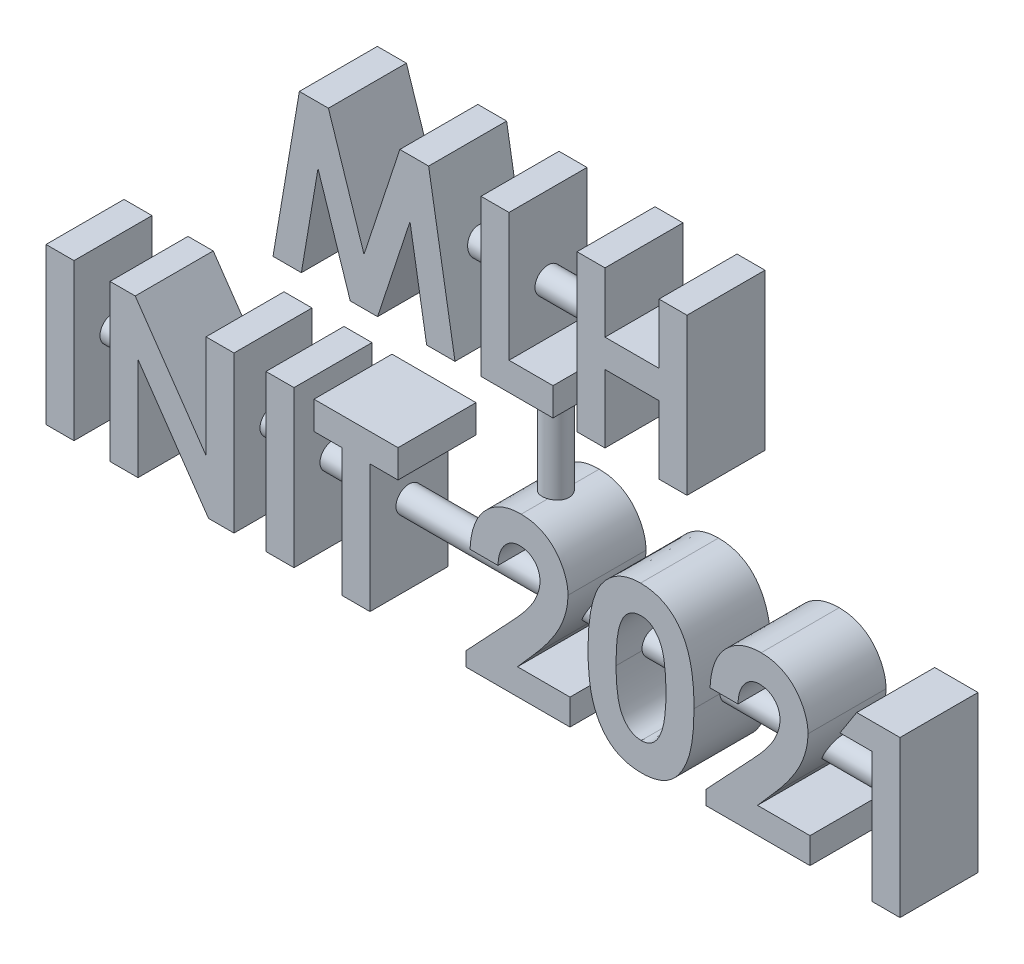
from build123d import *

# Parameters (mm, degrees)
BOSS_EXTRUDE1_DEPTH    = 15
BOSS_EXTRUDE1_2_DEPTH  = 15
BOSS_EXTRUDE1_3_DEPTH  = 15
SKETCH1_W              = 5.384615385
SKETCH1_H              = 30
BOSS_EXTRUDE1_4_DEPTH  = 15
BOSS_EXTRUDE1_5_DEPTH  = 15
BOSS_EXTRUDE1_6_DEPTH  = 15
BOSS_EXTRUDE1_7_DEPTH  = 15
BOSS_EXTRUDE1_8_DEPTH  = 15
BOSS_EXTRUDE1_9_DEPTH  = 15
BOSS_EXTRUDE1_10_DEPTH = 15
BOSS_EXTRUDE1_11_DEPTH = 15
BOSS_EXTRUDE2_START    = -47.574119
SKETCH2_R              = 2.5
BOSS_EXTRUDE2_DEPTH    = 42.189504
BOSS_EXTRUDE3_START    = -158.846154
SKETCH4_R              = 2.5
BOSS_EXTRUDE3_DEPTH    = 153.461539
BOSS_EXTRUDE4_REACH    = 101.896
SKETCH5_R              = 2.5


with BuildPart() as part:
    # Sketch1 → Boss-Extrude1 (new body)
    with BuildSketch(Plane.XY):
        Polygon((-36.087740385, 30), (-30.498798077, 30), (-23.653846154, 9.074519231), (-16.760817308, 30), (-11.225961538, 30), (-6.153846154, 0), (-11.604567308, 0), (-14.807692308, 18.948317308), (-21.045673077, 0), (-26.298076923, 0), (-32.5, 18.948317308), (-35.697115385, 0), (-41.153846154, 0), align=None)
    extrude(amount=BOSS_EXTRUDE1_DEPTH)



with BuildPart() as body_2:
    # Sketch1 → Boss-Extrude1 2 (new body)
    with BuildSketch(Plane.XY):
        Polygon((-1.153846154, 30), (4.230769231, 30), (4.230769231, 5.384615385), (12.692307692, 5.384615385), (12.692307692, 0), (-1.153846154, 0), align=None)
    extrude(amount=BOSS_EXTRUDE1_2_DEPTH)


with BuildPart() as body_3:
    # Sketch1 → Boss-Extrude1 3 (new body)
    with BuildSketch(Plane.XY):
        Polygon((17.307692308, 30), (22.692307692, 30), (22.692307692, 18.461538462), (33.076923077, 18.461538462), (33.076923077, 30), (38.461538462, 30), (38.461538462, 0), (33.076923077, 0), (33.076923077, 13.076923077), (22.692307692, 13.076923077), (22.692307692, 0), (17.307692308, 0), align=None)
    extrude(amount=BOSS_EXTRUDE1_3_DEPTH)


with BuildPart() as body_4:
    # Sketch1 → Boss-Extrude1 4 (new body)
    with BuildSketch(Plane.XY):
        with Locations((-82.115384616, -34.846153846)):
            Rectangle(SKETCH1_W, SKETCH1_H)
    extrude(amount=BOSS_EXTRUDE1_4_DEPTH)



with BuildPart() as body_5:
    # Sketch1 → Boss-Extrude1 5 (new body)
    with BuildSketch(Plane.XY):
        Polygon((-72.5, -19.846153846), (-67.650240385, -19.846153846), (-54.038461538, -39.587740385), (-54.038461538, -19.846153846), (-48.653846154, -19.846153846), (-48.653846154, -49.846153846), (-53.539663462, -49.846153846), (-67.115384615, -30.164663462), (-67.115384615, -49.846153846), (-72.5, -49.846153846), align=None)
    extrude(amount=BOSS_EXTRUDE1_5_DEPTH)


with BuildPart() as body_6:
    # Sketch1 → Boss-Extrude1 6 (new body)
    with BuildSketch(Plane.XY):
        with Locations((-39.807692308, -34.846153846)):
            Rectangle(SKETCH1_W, SKETCH1_H)
    extrude(amount=BOSS_EXTRUDE1_6_DEPTH)


with BuildPart() as body_7:
    # Sketch1 → Boss-Extrude1 7 (new body)
    with BuildSketch(Plane.XY):
        Polygon((-33.269230769, -19.846153846), (-17.115384615, -19.846153846), (-17.115384615, -25.230769231), (-22.5, -25.230769231), (-22.5, -49.846153846), (-27.884615385, -49.846153846), (-27.884615385, -25.230769231), (-33.269230769, -25.230769231), align=None)
    extrude(amount=BOSS_EXTRUDE1_7_DEPTH)


with BuildPart() as body_8:
    # Sketch1 → Boss-Extrude1 8 (new body)
    with BuildSketch(Plane.XY):
        with BuildLine():
            Line((2.115384615, -29.846153846), (-3.269230769, -29.846153846))
            add(Edge.make_bspline(
                [(-3.269230769, -29.846153846), (-3.245975441, -29.438836179), (-3.200535926, -28.642961913), (-3.019789022, -27.486929058), (-2.777594372, -26.394605133), (-2.454353461, -25.369811205), (-2.048180106, -24.412919651), (-1.569526193, -23.520668377), (-1.006163204, -22.697755105), (-0.370081355, -21.948148388), (0.327920434, -21.275669284), (1.07335096, -20.679407064), (1.877612588, -20.187386486), (2.7260108, -19.782499102), (3.618401131, -19.459012896), (4.563226995, -19.24273619), (5.552307578, -19.096271486), (6.229413331, -19.083455237), (6.574519231, -19.076923077)],
                knots=[0, 0, 0, 0, 1.199038563, 2.342849363, 3.436047546, 4.486744587, 5.497670872, 6.488682221, 7.459191391, 8.424610317, 9.374430501, 10.305433194, 11.225809216, 12.140057399, 13.06607119, 14.010487599, 14.985989317, 16, 16, 16, 16], degree=3))
            add(Edge.make_bspline(
                [(6.574519231, -19.076923077), (6.998131827, -19.090140907), (7.825122887, -19.115945208), (9.026806493, -19.336064461), (10.149047593, -19.704247927), (11.191030424, -20.218697328), (12.143884401, -20.872251365), (13.007451516, -21.651507593), (13.755616123, -22.572815215), (14.393121805, -23.597840125), (14.922812834, -24.683197245), (15.293998244, -25.805501515), (15.537974418, -26.93497153), (15.563995987, -27.69549947), (15.576923077, -28.073317308)],
                knots=[0, 0, 0, 0, 1.075374347, 2.099382735, 3.09057751, 4.06680945, 5.040638231, 6.016817125, 7.011024321, 8.044445721, 9.0776792, 10.070479129, 11.0414456, 12, 12, 12, 12], degree=3))
            add(Edge.make_bspline(
                [(15.576923077, -28.073317308), (15.571889951, -28.301848239), (15.561759511, -28.761824553), (15.491321219, -29.457881611), (15.385649862, -30.166897103), (15.226323208, -30.888263116), (15.027629809, -31.622181859), (14.786585996, -32.370849699), (14.497600522, -33.130021963), (14.165495967, -33.908243007), (13.769294391, -34.708039408), (13.307972729, -35.541400427), (12.769286457, -36.407586805), (12.159742226, -37.311489315), (11.476379627, -38.251682361), (10.715862709, -39.225333789), (9.88695084, -40.235874435), (9.298648769, -40.911364147), (8.996394231, -41.258413462)],
                knots=[0, 0, 0, 0, 0.728284026, 1.46585585, 2.227944881, 3.01186502, 3.81876927, 4.650621989, 5.517437689, 6.406905708, 7.346299482, 8.360816762, 9.441613733, 10.596154504, 11.834900912, 13.145207542, 14.533280747, 16, 16, 16, 16], degree=3))
            Line((8.996394231, -41.258413462), (5.865384615, -44.846153846))
            Line((5.865384615, -44.846153846), (15.961538462, -44.846153846))
            Line((15.961538462, -44.846153846), (15.961538462, -49.846153846))
            Line((15.961538462, -49.846153846), (-4.038461538, -49.846153846))
            Line((-4.038461538, -49.846153846), (-4.038461538, -47.117788462))
            Line((-4.038461538, -47.117788462), (4.84375, -37.664663462))
            add(Edge.make_bspline(
                [(4.84375, -37.664663462), (5.100912849, -37.38891287), (5.598961026, -36.854865749), (6.307632254, -36.070560736), (6.948917115, -35.326274), (7.509518046, -34.614080388), (8.018854662, -33.957080564), (8.454215683, -33.335471731), (8.819584321, -32.754873459), (9.216243799, -32.054773344), (9.592939912, -31.219779374), (9.938581394, -30.257832084), (10.149273797, -29.338432016), (10.178356011, -28.739331169), (10.192307692, -28.451923077)],
                knots=[0, 0, 0, 0, 1.246127091, 2.413378631, 3.493388633, 4.492180848, 5.408488754, 6.240484944, 6.999099869, 7.674939598, 8.898438119, 10.020720584, 11.050475521, 12, 12, 12, 12], degree=3))
            add(Edge.make_bspline(
                [(10.192307692, -28.451923077), (10.181876358, -28.173877921), (10.161663974, -27.635120855), (9.93954626, -26.868741796), (9.595433794, -26.174863791), (9.11053073, -25.574220699), (8.52316125, -25.080632441), (7.844400641, -24.713515362), (7.0797828, -24.501690491), (6.543771126, -24.475177585), (6.268028846, -24.461538462)],
                knots=[0, 0, 0, 0, 1.062038974, 2.057870785, 3.028805853, 4.01125022, 4.991535629, 5.949134679, 6.94496649, 8, 8, 8, 8], degree=3))
            add(Edge.make_bspline(
                [(6.268028846, -24.461538462), (6.125576872, -24.466576917), (5.845137285, -24.476495926), (5.432913011, -24.542524083), (5.040651998, -24.658891818), (4.663988164, -24.814808205), (4.306941362, -25.021476494), (3.97041218, -25.276228088), (3.650854855, -25.572589168), (3.349735007, -25.909633054), (3.075676636, -26.285774129), (2.832258993, -26.697577114), (2.630993125, -27.144786391), (2.453791339, -27.621498114), (2.317124843, -28.132832556), (2.21761468, -28.675729437), (2.141963748, -29.249305536), (2.1244055, -29.643585168), (2.115384615, -29.846153846)],
                knots=[0, 0, 0, 0, 0.903469896, 1.778625579, 2.63899355, 3.493148037, 4.358286772, 5.247621495, 6.164656832, 7.118446693, 8.109501108, 9.111810964, 10.146451449, 11.215617525, 12.33435995, 13.498009769, 14.714554818, 16, 16, 16, 16], degree=3))
        make_face()
    extrude(amount=BOSS_EXTRUDE1_8_DEPTH)


with BuildPart() as body_9:
    # Sketch1 → Boss-Extrude1 9 (new body)
    with BuildSketch(Plane.XY):
        with BuildLine():
            add(Edge.make_bspline(
                [(29.525240385, -19.076923077), (29.785878118, -19.080792318), (30.29836154, -19.088400278), (31.053153152, -19.170800691), (31.780226161, -19.295284734), (32.482424967, -19.468896566), (33.154695072, -19.698665641), (33.801929397, -19.973695285), (34.416423979, -20.30841137), (35.00601559, -20.686490378), (35.570477116, -21.114529413), (36.096242121, -21.602516014), (36.59291219, -22.139221588), (37.049736245, -22.732760162), (37.476830795, -23.377732873), (37.872792478, -24.074241993), (38.23459011, -24.825696467), (38.566278578, -25.633452355), (38.862875454, -26.509617569), (39.112698635, -27.464242103), (39.326963816, -28.497543963), (39.507818746, -29.612095194), (39.644515843, -30.809377301), (39.736652438, -32.088594868), (39.799880931, -33.447281753), (39.8050412, -34.379329793), (39.807692308, -34.858173077)],
                knots=[0, 0, 0, 0, 0.879237366, 1.728815576, 2.559023295, 3.367336655, 4.166867292, 4.954216142, 5.737608147, 6.525189134, 7.316157332, 8.124696809, 8.942788509, 9.781158001, 10.649253743, 11.551476218, 12.482711956, 13.461909668, 14.496590415, 15.601789533, 16.789733467, 18.056700938, 19.410929216, 20.8549011, 22.384193279, 24, 24, 24, 24], degree=3))
            add(Edge.make_bspline(
                [(39.807692308, -34.858173077), (39.804827176, -35.343007229), (39.799260277, -36.28503129), (39.739280865, -37.656145416), (39.635993483, -38.94465087), (39.502869252, -40.15041435), (39.320525469, -41.272799109), (39.106975552, -42.314711371), (38.853208987, -43.275773467), (38.546842305, -44.15381992), (38.217161555, -44.962994404), (37.854374251, -45.712983721), (37.464803726, -46.405819256), (37.057385554, -47.051953377), (36.60978357, -47.632338377), (36.143783827, -48.166710381), (35.639095862, -48.634714475), (35.116968991, -49.060469488), (34.558275593, -49.42840726), (33.968777328, -49.750199569), (33.337964464, -50.011211352), (32.677335647, -50.238225459), (31.975630326, -50.401197093), (31.2439985, -50.530509729), (30.474180196, -50.601975823), (29.950056887, -50.610841663), (29.681490385, -50.615384615)],
                knots=[0, 0, 0, 0, 1.643780988, 3.193836972, 4.651895693, 6.025988579, 7.305620092, 8.505800249, 9.631074763, 10.672816429, 11.65661981, 12.592235626, 13.49536222, 14.350718032, 15.179365177, 15.97804903, 16.751647189, 17.51006938, 18.259804725, 19.016521909, 19.783502495, 20.571750527, 21.382245291, 22.22305063, 23.089471752, 24, 24, 24, 24], degree=3))
            add(Edge.make_bspline(
                [(29.681490385, -50.615384615), (29.412931131, -50.610754032), (28.886827502, -50.601682787), (28.114927533, -50.53104111), (27.379418426, -50.400673245), (26.672161488, -50.236974283), (25.998079114, -50.011713643), (25.353939101, -49.742892575), (24.744694327, -49.42310809), (24.16865789, -49.054313057), (23.627796542, -48.631406667), (23.113705301, -48.158912377), (22.627521367, -47.63802784), (22.176640801, -47.062918716), (21.753679487, -46.441261514), (21.363048241, -45.765957211), (21.004981823, -45.037989033), (20.668279848, -44.256342269), (20.375728452, -43.404188959), (20.115371294, -42.473919482), (19.902093558, -41.457779275), (19.730561331, -40.356094784), (19.593610099, -39.171199976), (19.491734124, -37.902522936), (19.431421554, -36.549472745), (19.425913036, -35.61945395), (19.423076923, -35.140625)],
                knots=[0, 0, 0, 0, 0.917216111, 1.796812873, 2.643793957, 3.46689424, 4.273913431, 5.068098542, 5.848489301, 6.620921603, 7.401012384, 8.190319798, 9.003608147, 9.831726257, 10.68377682, 11.569763213, 12.493818149, 13.453288342, 14.474581811, 15.568529029, 16.750744269, 18.018426408, 19.375425659, 20.823733699, 22.36466933, 24, 24, 24, 24], degree=3))
            add(Edge.make_bspline(
                [(19.423076923, -35.140625), (19.428214276, -34.475329869), (19.438126865, -33.191634344), (19.563746468, -31.337067543), (19.748124184, -29.622841794), (20.018931374, -28.051824573), (20.353780719, -26.618197291), (20.782572741, -25.331403934), (21.270721266, -24.17363883), (21.686686523, -23.487771812), (21.887019231, -23.157451923)],
                knots=[0, 0, 0, 0, 1.288568992, 2.486310467, 3.599230591, 4.627010532, 5.572937695, 6.447898582, 7.252493626, 8, 8, 8, 8], degree=3))
            add(Edge.make_bspline(
                [(21.887019231, -23.157451923), (22.119956562, -22.832945768), (22.575394944, -22.19847229), (23.371741685, -21.365527213), (24.227312575, -20.653151796), (25.159680553, -20.077467731), (26.154099831, -19.623483231), (27.219108004, -19.302839092), (28.350772175, -19.116016875), (29.127904838, -19.09014894), (29.525240385, -19.076923077)],
                knots=[0, 0, 0, 0, 1.058512271, 2.069600068, 3.047294572, 4.004278952, 4.967380941, 5.939006123, 6.946246673, 8, 8, 8, 8], degree=3))
        make_face()
        with BuildLine():
            add(Edge.make_bspline(
                [(29.657451923, -24.461538462), (29.421833251, -24.472706318), (28.959895579, -24.494601245), (28.289602008, -24.680458287), (27.657557021, -24.967524509), (27.176777281, -25.312963824), (26.816918427, -25.644108833), (26.565482465, -25.943784297), (26.323012109, -26.278200517), (26.108850081, -26.662447977), (25.906625221, -27.082720213), (25.708990578, -27.540925008), (25.546982067, -28.048316864), (25.387813, -28.596254831), (25.248366046, -29.19988794), (25.131540069, -29.864150223), (25.027166327, -30.593361442), (24.954364398, -31.387999228), (24.886491152, -32.247232196), (24.837836395, -33.172974384), (24.817495062, -34.164976045), (24.811029171, -34.848152867), (24.807692308, -35.200721154)],
                knots=[0, 0, 0, 0, 1.076674018, 2.110852608, 3.161083442, 4.239746716, 4.804137807, 5.395870207, 6.026861976, 6.692161227, 7.405688833, 8.16177676, 8.973626916, 9.841385931, 10.773283133, 11.807421078, 12.927755683, 14.143907515, 15.458935494, 16.872852025, 18.386167141, 20, 20, 20, 20], degree=3))
            add(Edge.make_bspline(
                [(24.807692308, -35.200721154), (24.813184381, -35.657490414), (24.823715838, -36.533379335), (24.878874687, -37.792938103), (24.989436024, -38.939238005), (25.126952004, -39.980047938), (25.320098813, -40.908617974), (25.54232672, -41.733733244), (25.816758425, -42.444875533), (26.133917139, -43.052329558), (26.485184705, -43.569089435), (26.8665011, -44.008337658), (27.264883868, -44.388705895), (27.692767829, -44.697674327), (28.149132181, -44.934453491), (28.630167121, -45.10476582), (29.136178339, -45.209021089), (29.482689605, -45.223477943), (29.657451923, -45.230769231)],
                knots=[0, 0, 0, 0, 1.771748488, 3.397459088, 4.888034009, 6.237357457, 7.467047327, 8.564189669, 9.548206622, 10.417051504, 11.216568818, 11.965764335, 12.669334354, 13.348544111, 14.005342236, 14.656555988, 15.322436492, 16, 16, 16, 16], degree=3))
            add(Edge.make_bspline(
                [(29.657451923, -45.230769231), (29.826216952, -45.22577999), (30.156637894, -45.216011677), (30.638465627, -45.115741256), (31.094116168, -44.952723331), (31.522213767, -44.72212303), (31.924289669, -44.428879466), (32.298378774, -44.071704), (32.641659778, -43.647036426), (32.841656849, -43.331870279), (32.944711538, -43.169471154)],
                knots=[0, 0, 0, 0, 0.992283464, 1.942767638, 2.88273346, 3.832339453, 4.79467288, 5.803907806, 6.868395428, 8, 8, 8, 8], degree=3))
            add(Edge.make_bspline(
                [(32.944711538, -43.169471154), (33.06604108, -42.947557939), (33.320459288, -42.482223924), (33.614872477, -41.696990125), (33.862693091, -40.81137618), (34.07598867, -39.822625976), (34.221869834, -38.726839759), (34.347502515, -37.530966005), (34.408098278, -36.228982778), (34.41795451, -35.326964101), (34.423076923, -34.858173077)],
                knots=[0, 0, 0, 0, 0.710965849, 1.490837728, 2.352621235, 3.297892224, 4.334225155, 5.461620853, 6.680770821, 8, 8, 8, 8], degree=3))
            add(Edge.make_bspline(
                [(34.423076923, -34.858173077), (34.421098245, -34.385312721), (34.417289629, -33.475137257), (34.347412541, -32.168473308), (34.250103356, -30.975052651), (34.107768111, -29.897539709), (33.924627948, -28.933318751), (33.698907005, -28.082452811), (33.432798804, -27.343264995), (33.117226191, -26.716492375), (32.767709915, -26.183821628), (32.396687719, -25.726831444), (32.002590769, -25.336664754), (31.586078124, -25.011853294), (31.137509453, -24.763672976), (30.665453003, -24.588437142), (30.168941021, -24.482425338), (29.830249558, -24.468594727), (29.657451923, -24.461538462)],
                knots=[0, 0, 0, 0, 1.793836731, 3.452829483, 4.963243077, 6.335886805, 7.574563692, 8.684454726, 9.672768357, 10.54971625, 11.340229787, 12.085688095, 12.778991901, 13.440269426, 14.083255152, 14.715733572, 15.344777694, 16, 16, 16, 16], degree=3))
        make_face(mode=Mode.SUBTRACT)
    extrude(amount=BOSS_EXTRUDE1_9_DEPTH)


with BuildPart() as body_10:
    # Sketch1 → Boss-Extrude1 10 (new body)
    with BuildSketch(Plane.XY):
        with BuildLine():
            Line((48.269230769, -29.846153846), (42.884615385, -29.846153846))
            add(Edge.make_bspline(
                [(42.884615385, -29.846153846), (42.907870713, -29.438836179), (42.953310227, -28.642961913), (43.134057132, -27.486929058), (43.376251782, -26.394605133), (43.699492693, -25.369811205), (44.105666048, -24.412919651), (44.584319961, -23.520668377), (45.14768295, -22.697755105), (45.783764799, -21.948148388), (46.481766588, -21.275669284), (47.227197114, -20.679407064), (48.031458742, -20.187386486), (48.879856953, -19.782499102), (49.772247284, -19.459012896), (50.717073149, -19.24273619), (51.706153732, -19.096271486), (52.383259485, -19.083455237), (52.728365385, -19.076923077)],
                knots=[0, 0, 0, 0, 1.199038563, 2.342849363, 3.436047546, 4.486744587, 5.497670872, 6.488682221, 7.459191391, 8.424610317, 9.374430501, 10.305433194, 11.225809216, 12.140057399, 13.06607119, 14.010487599, 14.985989317, 16, 16, 16, 16], degree=3))
            add(Edge.make_bspline(
                [(52.728365385, -19.076923077), (53.151977981, -19.090140907), (53.97896904, -19.115945208), (55.180652647, -19.336064461), (56.302893747, -19.704247927), (57.344876577, -20.218697328), (58.297730555, -20.872251365), (59.16129767, -21.651507593), (59.909462277, -22.572815215), (60.546967958, -23.597840125), (61.076658988, -24.683197245), (61.447844397, -25.805501515), (61.691820572, -26.93497153), (61.717842141, -27.69549947), (61.730769231, -28.073317308)],
                knots=[0, 0, 0, 0, 1.075374347, 2.099382735, 3.09057751, 4.06680945, 5.040638231, 6.016817125, 7.011024321, 8.044445721, 9.0776792, 10.070479129, 11.0414456, 12, 12, 12, 12], degree=3))
            add(Edge.make_bspline(
                [(61.730769231, -28.073317308), (61.725736105, -28.301848239), (61.715605665, -28.761824553), (61.645167373, -29.457881611), (61.539496016, -30.166897103), (61.380169362, -30.888263116), (61.181475962, -31.622181859), (60.94043215, -32.370849699), (60.651446676, -33.130021963), (60.319342121, -33.908243007), (59.923140545, -34.708039408), (59.461818883, -35.541400427), (58.923132611, -36.407586805), (58.31358838, -37.311489315), (57.630225781, -38.251682361), (56.869708863, -39.225333789), (56.040796994, -40.235874435), (55.452494922, -40.911364147), (55.150240385, -41.258413462)],
                knots=[0, 0, 0, 0, 0.728284026, 1.46585585, 2.227944881, 3.01186502, 3.81876927, 4.650621989, 5.517437689, 6.406905708, 7.346299482, 8.360816762, 9.441613733, 10.596154504, 11.834900912, 13.145207542, 14.533280747, 16, 16, 16, 16], degree=3))
            Line((55.150240385, -41.258413462), (52.019230769, -44.846153846))
            Line((52.019230769, -44.846153846), (62.115384615, -44.846153846))
            Line((62.115384615, -44.846153846), (62.115384615, -49.846153846))
            Line((62.115384615, -49.846153846), (42.115384615, -49.846153846))
            Line((42.115384615, -49.846153846), (42.115384615, -47.117788462))
            Line((42.115384615, -47.117788462), (50.997596154, -37.664663462))
            add(Edge.make_bspline(
                [(50.997596154, -37.664663462), (51.254759003, -37.38891287), (51.75280718, -36.854865749), (52.461478408, -36.070560736), (53.102763269, -35.326274), (53.6633642, -34.614080388), (54.172700816, -33.957080564), (54.608061836, -33.335471731), (54.973430475, -32.754873459), (55.370089953, -32.054773344), (55.746786066, -31.219779374), (56.092427548, -30.257832084), (56.303119951, -29.338432016), (56.332202165, -28.739331169), (56.346153846, -28.451923077)],
                knots=[0, 0, 0, 0, 1.246127091, 2.413378631, 3.493388633, 4.492180848, 5.408488754, 6.240484944, 6.999099869, 7.674939598, 8.898438119, 10.020720584, 11.050475521, 12, 12, 12, 12], degree=3))
            add(Edge.make_bspline(
                [(56.346153846, -28.451923077), (56.335722512, -28.173877921), (56.315510128, -27.635120855), (56.093392414, -26.868741796), (55.749279948, -26.174863791), (55.264376884, -25.574220699), (54.677007404, -25.080632441), (53.998246795, -24.713515362), (53.233628954, -24.501690491), (52.69761728, -24.475177585), (52.421875, -24.461538462)],
                knots=[0, 0, 0, 0, 1.062038974, 2.057870785, 3.028805853, 4.01125022, 4.991535629, 5.949134679, 6.94496649, 8, 8, 8, 8], degree=3))
            add(Edge.make_bspline(
                [(52.421875, -24.461538462), (52.279423026, -24.466576917), (51.998983438, -24.476495926), (51.586759165, -24.542524083), (51.194498152, -24.658891818), (50.817834317, -24.814808205), (50.460787516, -25.021476494), (50.124258333, -25.276228088), (49.804701009, -25.572589168), (49.503581161, -25.909633054), (49.22952279, -26.285774129), (48.986105147, -26.697577114), (48.784839278, -27.144786391), (48.607637493, -27.621498114), (48.470970997, -28.132832556), (48.371460834, -28.675729437), (48.295809902, -29.249305536), (48.278251654, -29.643585168), (48.269230769, -29.846153846)],
                knots=[0, 0, 0, 0, 0.903469896, 1.778625579, 2.63899355, 3.493148037, 4.358286772, 5.247621495, 6.164656832, 7.118446693, 8.109501108, 9.111810964, 10.146451449, 11.215617525, 12.33435995, 13.498009769, 14.714554818, 16, 16, 16, 16], degree=3))
        make_face()
    extrude(amount=BOSS_EXTRUDE1_10_DEPTH)


with BuildPart() as body_11:
    # Sketch1 → Boss-Extrude1 11 (new body)
    with BuildSketch(Plane.XY):
        Polygon((71.099759615, -19.846153846), (79.423076923, -19.846153846), (79.423076923, -49.846153846), (74.038461538, -49.846153846), (74.038461538, -24.846153846), (67.884615385, -24.846153846), align=None)
    extrude(amount=BOSS_EXTRUDE1_11_DEPTH)


with BuildPart() as part_1:
    add(part.part)

    add(body_2.part)  # Boss-Extrude2 merges body 2

    add(body_3.part)  # Boss-Extrude2 merges body 3
    # Sketch2 → Boss-Extrude2 (add)
    with BuildSketch(Plane(origin=(38.461538462, 0, 0), x_dir=(0, 0, -1), z_dir=(1, 0, 0)).offset(BOSS_EXTRUDE2_START)):
        with Locations((-7.5, 15)):
            Circle(SKETCH2_R)
    extrude(amount=BOSS_EXTRUDE2_DEPTH)


with BuildPart() as body_4_1:
    add(body_4.part)

    add(body_5.part)  # Boss-Extrude3 merges body 5

    add(body_6.part)  # Boss-Extrude3 merges body 6

    add(body_7.part)  # Boss-Extrude3 merges body 7

    add(body_8.part)  # Boss-Extrude3 merges body 8

    add(body_9.part)  # Boss-Extrude3 merges body 9

    add(body_10.part)  # Boss-Extrude3 merges body 10

    add(body_11.part)  # Boss-Extrude3 merges body 11
    # Sketch4 → Boss-Extrude3 (add)
    with BuildSketch(Plane(origin=(79.423076923, 0, 0), x_dir=(0, 0, -1), z_dir=(1, 0, 0)).offset(BOSS_EXTRUDE3_START)):
        with Locations((-7.5, -34.846153846)):
            Circle(SKETCH4_R)
    extrude(amount=BOSS_EXTRUDE3_DEPTH)

    # Sketch5 → Boss-Extrude4 (add, up to next)
    with BuildSketch(Plane.XZ, mode=Mode.PRIVATE) as boss_extrude4_sk1:
        with Locations(Location((5.769230769, 7.5, 0), (0, 0, 71.209097278))):
            Circle(SKETCH5_R)
    boss_extrude4_tool1 = extrude(boss_extrude4_sk1.sketch, amount=BOSS_EXTRUDE4_REACH, mode=Mode.PRIVATE) - body_4_1.part

    add(part_1.part)  # Boss-Extrude4 merges part
    add(boss_extrude4_tool1.solids().sort_by_distance((5.769231, 0, 7.5))[0])


solid = body_4_1.part
